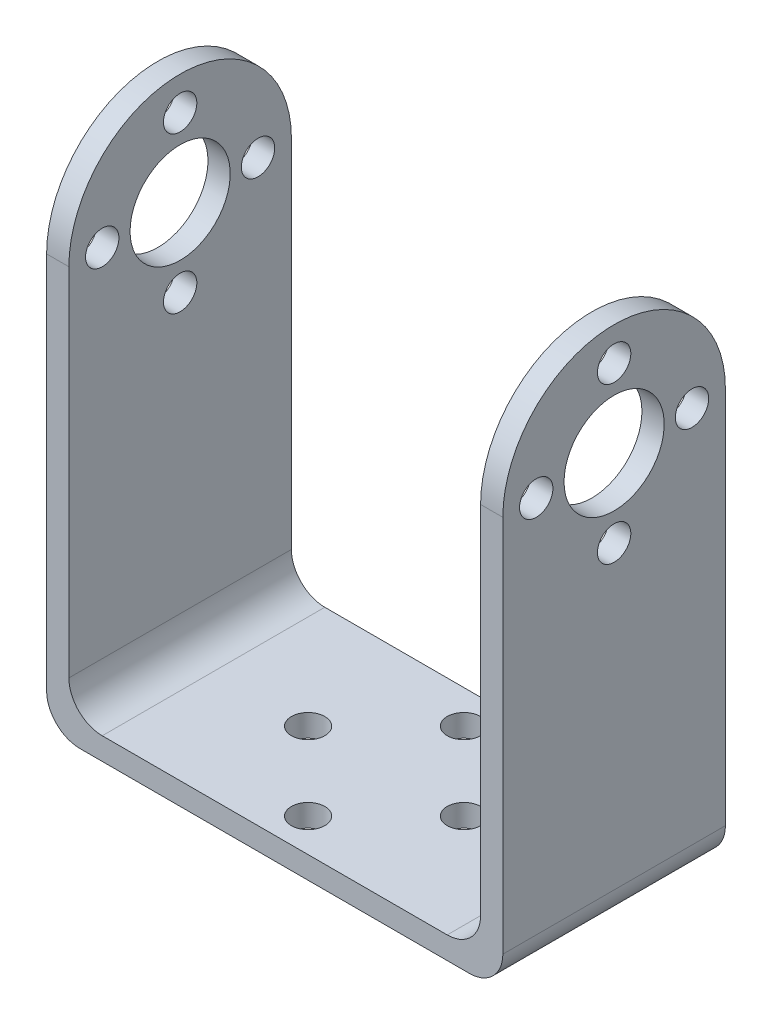
from build123d import *

# Parameters (mm, degrees)
EXTRUDE_1_DEPTH     = 2
SKETCH_2_W          = 2
SKETCH_2_H          = 20
EXTRUDE_2_DEPTH     = 60
FILLET_1_R          = 3
SKETCH_6_R          = 4.5
SKETCH_6_R_2        = 1.5
CUT_EXTRUDE_2_DEPTH = 76
SKETCH_7_R          = 1.5
CUT_EXTRUDE_3_DEPTH = 10


with BuildPart() as part:
    # 草图1 → 凸台-拉伸1 (new body)
    with BuildSketch(Plane(origin=(0, 0, 0), x_dir=(1, 0, 0), z_dir=(0, 1, 0))):
        Polygon((-20.5, 10), (-12.5, 10), (12.5, 10), (20.5, 10), (20.5, -10), (12.5, -10), (-12.5, -10), (-20.5, -10), align=None)
    extrude(amount=EXTRUDE_1_DEPTH)

    # 草图2 → 凸台-拉伸2 (add)
    with BuildSketch(Plane(origin=(0, 2, 0), x_dir=(1, 0, 0), z_dir=(0, 1, 0))):
        with Locations((-19.5, 0)):
            Rectangle(SKETCH_2_W, SKETCH_2_H)
        with Locations((19.5, 0)):
            Rectangle(SKETCH_2_W, SKETCH_2_H)
    extrude(amount=EXTRUDE_2_DEPTH)

    # 圆角1
    fillet_1_edges = [part.edges().sort_by_distance(p)[0] for p in [
        (20.5, 0, 0),
        (-18.5, 2, 0),
        (18.5, 2, 0),
        (-20.5, 0, 0),
    ]]
    fillet(fillet_1_edges, radius=FILLET_1_R)

    # 草图6 → 切除-拉伸2 (cut, through all)
    with BuildSketch(Plane.ZY.offset(20.5)):
        with Locations((0, 37)):
            Circle(SKETCH_6_R)
        with Locations((0, 30)):
            Circle(SKETCH_6_R_2)
        with Locations((-7, 37)):
            Circle(SKETCH_6_R_2)
        with Locations((0, 44)):
            Circle(SKETCH_6_R_2)
        with Locations((7, 37)):
            Circle(SKETCH_6_R_2)
        with BuildLine():
            Line((-10, 37), (-10, 62))
            Line((-10, 62), (10, 62))
            Line((10, 62), (10, 37))
            ThreePointArc((10, 37), (0, 47), (-10, 37))
        make_face()
    extrude(amount=-CUT_EXTRUDE_2_DEPTH, mode=Mode.SUBTRACT)

    # 草图7 → 切除-拉伸3 (cut)
    with BuildSketch(Plane.XZ):
        with Locations(Location((-7, 0, 0), (0, 0, 270))):
            Circle(SKETCH_7_R)
        with Locations(Location((0, 7, 0), (0, 0, 270))):
            Circle(SKETCH_7_R)
        with Locations(Location((7, 0, 0), (0, 0, 270))):
            Circle(SKETCH_7_R)
        with Locations(Location((0, -7, 0), (0, 0, 270))):
            Circle(SKETCH_7_R)
    extrude(amount=-CUT_EXTRUDE_3_DEPTH, mode=Mode.SUBTRACT)


solid = part.part
